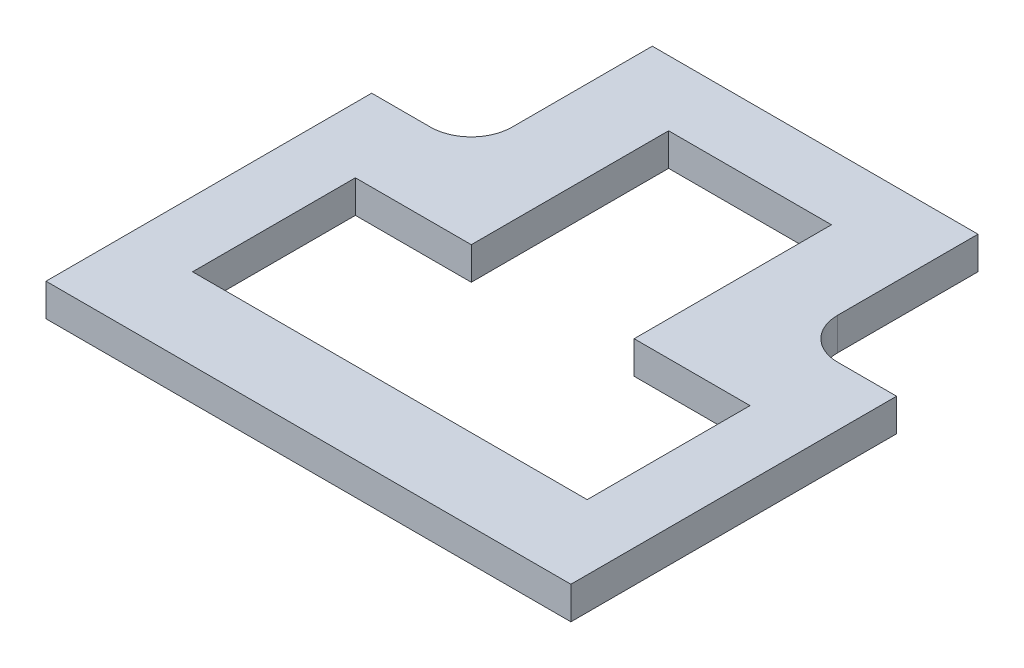
from build123d import *

# Parameters (mm, degrees)
CROQUIS1_W                = 30
CROQUIS1_H                = 30
SALIENTE_EXTRUIR1_DEPTH   = 3
CROQUIS2_W                = 15
CROQUIS2_H                = 30
SALIENTE_EXTRUIR3_DEPTH   = 3
SALIENTE_EXTRUIR3_2_DEPTH = 3
CROQUIS3_W                = 30
CROQUIS3_H                = 30
SALIENTE_EXTRUIR4_DEPTH   = 3
SALIENTE_EXTRUIR5_DEPTH   = 3
CORTAR_EXTRUIR1_DEPTH     = 6
SALIENTE_EXTRUIR8_DEPTH   = 11
CROQUIS7_W                = 30
CROQUIS7_H                = 3.175
CORTAR_EXTRUIR3_DEPTH     = 18.542
CROQUIS9_W                = 60
CROQUIS9_H                = 0.175
SALIENTE_EXTRUIR9_DEPTH   = 11
CROQUIS10_W               = 90
CROQUIS10_H               = 5
CORTAR_EXTRUIR5_DEPTH     = 93
CROQUIS11_W               = 30
CROQUIS11_H               = 3.175
SALIENTE_EXTRUIR10_DEPTH  = 11
CROQUIS12_W               = 60
CROQUIS12_H               = 0.175
CORTAR_EXTRUIR6_DEPTH     = 11
CROQUIS14_W               = 30
CROQUIS14_H               = 6.35
CORTAR_EXTRUIR8_DEPTH     = 19.812
CROQUIS15_W               = 60
CROQUIS15_H               = 6.315381445
SALIENTE_EXTRUIR14_DEPTH  = 6
CROQUIS16_W               = 6.35
CROQUIS16_H               = 30
CORTAR_EXTRUIR9_DEPTH     = 10
CROQUIS17_W               = 3.35
CROQUIS17_H               = 60
SALIENTE_EXTRUIR15_DEPTH  = 6


with BuildPart() as part:
    # Croquis1 → Saliente-Extruir1 (new body)
    with BuildSketch(Plane(origin=(0, 0, 0), x_dir=(1, 0, 0), z_dir=(0, 1, 0))):
        Rectangle(CROQUIS1_W, CROQUIS1_H)
    extrude(amount=SALIENTE_EXTRUIR1_DEPTH)



with BuildPart() as body_2:
    # Croquis2 → Saliente-Extruir3 (new body)
    with BuildSketch(Plane(origin=(0, 3, 0), x_dir=(1, 0, 0), z_dir=(0, 1, 0))):
        with Locations((-22.5, -30)):
            Rectangle(CROQUIS2_W, CROQUIS2_H)
    extrude(amount=-SALIENTE_EXTRUIR3_DEPTH)


with BuildPart() as body_3:
    # Croquis2 → Saliente-Extruir3 2 (new body)
    with BuildSketch(Plane(origin=(0, 3, 0), x_dir=(1, 0, 0), z_dir=(0, 1, 0))):
        with Locations((22.5, -30)):
            Rectangle(CROQUIS2_W, CROQUIS2_H)
    extrude(amount=-SALIENTE_EXTRUIR3_2_DEPTH)


with BuildPart() as part_1:
    add(part.part)

    add(body_2.part)  # Saliente-Extruir4 merges body 2

    add(body_3.part)  # Saliente-Extruir4 merges body 3
    # Croquis3 → Saliente-Extruir4 (add)
    with BuildSketch(Plane(origin=(0, 3, 0), x_dir=(1, 0, 0), z_dir=(0, 1, 0))):
        with Locations((0, -30)):
            Rectangle(CROQUIS3_W, CROQUIS3_H)
    extrude(amount=-SALIENTE_EXTRUIR4_DEPTH)

    # Croquis4 → Saliente-Extruir5 (add)
    with BuildSketch(Plane(origin=(0, 3, 0), x_dir=(1, 0, 0), z_dir=(0, 1, 0))):
        Polygon((-30, 0), (-45, 0), (-45, -60), (45, -60), (45, 0), (30, 0), (30, 30), (-30, 30), align=None)
    extrude(amount=SALIENTE_EXTRUIR5_DEPTH)

    # Croquis5 → Cortar-Extruir1 (cut)
    with BuildSketch(Plane(origin=(0, 0, 0), x_dir=(-1, 0, 0), z_dir=(0, -1, 0))):
        Polygon((30, -45), (30, -15), (15, -15), (15, 15), (-15, 15), (-15, -15), (-30, -15), (-30, -45), align=None)
    extrude(amount=-CORTAR_EXTRUIR1_DEPTH, mode=Mode.SUBTRACT)

    # Croquis6 → Saliente-Extruir8 (add)
    with BuildSketch(Plane(origin=(0, 3, 0), x_dir=(-1, 0, 0), z_dir=(0, -1, 0))):
        with BuildLine():
            Line((37.5, 0), (45, 0))
            Line((45, 0), (45, -60))
            Line((45, -60), (-45, -60))
            Line((-45, -60), (-45, 0))
            Line((-45, 0), (-37.5, 0))
            ThreePointArc((-37.5, 0), (-32.196699141, 2.196699141), (-30, 7.5))
            Line((-30, 7.5), (-30, 30))
            Line((-30, 30), (30, 30))
            Line((30, 30), (30, 7.5))
            ThreePointArc((30, 7.5), (32.196699141, 2.196699141), (37.5, 0))
        make_face()
        Polygon((15, 15), (15, -15), (30, -15), (30, -45), (-30, -45), (-30, -15), (-15, -15), (-15, 15), align=None, mode=Mode.SUBTRACT)
    extrude(amount=-SALIENTE_EXTRUIR8_DEPTH)

    # Croquis7 → Cortar-Extruir3 (cut)
    with BuildSketch(Plane(origin=(0, 14, 0), x_dir=(1, 0, 0), z_dir=(0, 1, 0))):
        with Locations((0, 16.5875)):
            Rectangle(CROQUIS7_W, CROQUIS7_H)
    extrude(amount=-CORTAR_EXTRUIR3_DEPTH, mode=Mode.SUBTRACT)

    # Croquis9 → Saliente-Extruir9 (add)
    with BuildSketch(Plane(origin=(0, 14, 0), x_dir=(1, 0, 0), z_dir=(0, 1, 0))):
        with Locations((0, 30.0875)):
            Rectangle(CROQUIS9_W, CROQUIS9_H)
    extrude(amount=-SALIENTE_EXTRUIR9_DEPTH)

    # Croquis10 → Cortar-Extruir5 (cut)
    with BuildSketch(Plane.XY.offset(60)):
        with Locations((0, 5.5)):
            Rectangle(CROQUIS10_W, CROQUIS10_H)
    extrude(amount=-CORTAR_EXTRUIR5_DEPTH, mode=Mode.SUBTRACT)

    # Croquis11 → Saliente-Extruir10 (add)
    with BuildSketch(Plane(origin=(0, 14, 0), x_dir=(1, 0, 0), z_dir=(0, 1, 0))):
        with Locations((0, 16.5875)):
            Rectangle(CROQUIS11_W, CROQUIS11_H)
    extrude(amount=-SALIENTE_EXTRUIR10_DEPTH)

    # Croquis12 → Cortar-Extruir6 (cut)
    with BuildSketch(Plane(origin=(0, 14, 0), x_dir=(1, 0, 0), z_dir=(0, 1, 0))):
        with Locations((0, 30.0875)):
            Rectangle(CROQUIS12_W, CROQUIS12_H)
    extrude(amount=-CORTAR_EXTRUIR6_DEPTH, mode=Mode.SUBTRACT)

    # Croquis14 → Cortar-Extruir8 (cut)
    with BuildSketch(Plane(origin=(0, 14, 0), x_dir=(1, 0, 0), z_dir=(0, 1, 0))):
        with Locations((0, 18.175)):
            Rectangle(CROQUIS14_W, CROQUIS14_H)
    extrude(amount=-CORTAR_EXTRUIR8_DEPTH, mode=Mode.SUBTRACT)

    # Croquis15 → Saliente-Extruir14 (add)
    with BuildSketch(Plane(origin=(0, 14, 0), x_dir=(1, 0, 0), z_dir=(0, 1, 0))):
        with Locations((0, 30.192309278)):
            Rectangle(CROQUIS15_W, CROQUIS15_H)
    extrude(amount=-SALIENTE_EXTRUIR14_DEPTH)

    # Croquis16 → Cortar-Extruir9 (cut)
    with BuildSketch(Plane(origin=(0, 14, 0), x_dir=(1, 0, 0), z_dir=(0, 1, 0))):
        with Locations((-33.175, -30)):
            Rectangle(CROQUIS16_W, CROQUIS16_H)
        with Locations((33.175, -30)):
            Rectangle(CROQUIS16_W, CROQUIS16_H)
    extrude(amount=-CORTAR_EXTRUIR9_DEPTH, mode=Mode.SUBTRACT)

    # Croquis17 → Saliente-Extruir15 (add)
    with BuildSketch(Plane(origin=(0, 14, 0), x_dir=(1, 0, 0), z_dir=(0, 1, 0))):
        with Locations((-46.675, -30)):
            Rectangle(CROQUIS17_W, CROQUIS17_H)
        with Locations((46.675, -30)):
            Rectangle(CROQUIS17_W, CROQUIS17_H)
    extrude(amount=-SALIENTE_EXTRUIR15_DEPTH)


solid = part_1.part
